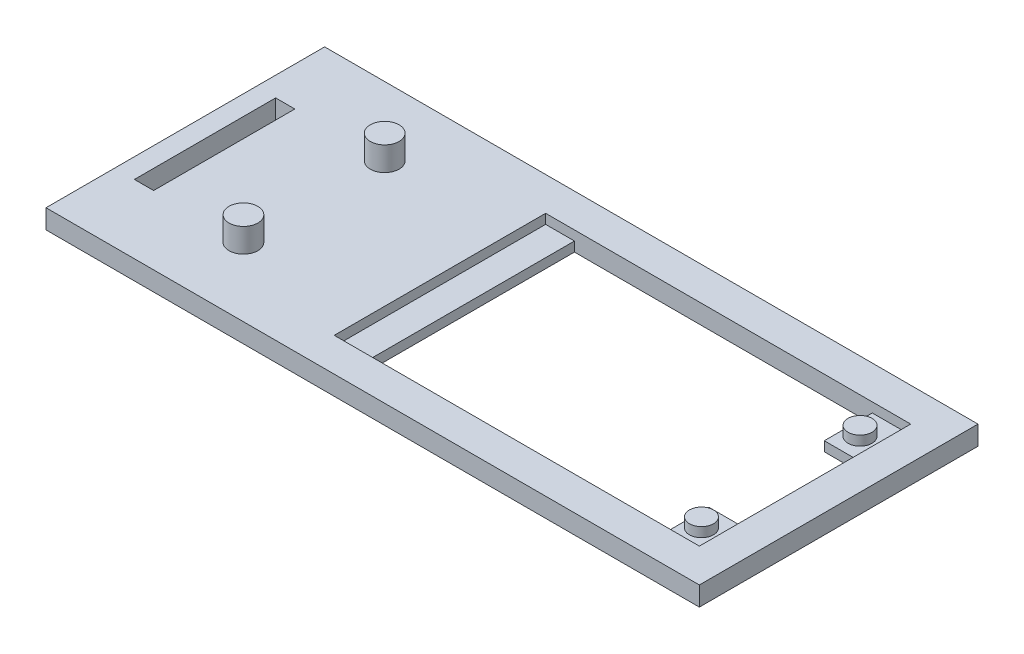
from build123d import *

# Parameters (mm, degrees)
SKETCH1_W             = 68
SKETCH1_H             = 29
BASE_DEPTH            = 2
SKETCH2_R             = 1.5
LEFT_PEG_DEPTH        = 2.5
SKETCH3_R             = 1.5
RIGHT_PEG_DEPTH       = 2.5
SKETCH4_W             = 2
SKETCH4_H             = 14.7
ACCEL_WIRE_HOLE_DEPTH = 2.5
SKETCH5_W             = 38
SKETCH5_H             = 22
OUTER_CUT_DEPTH       = 1
SKETCH6_W             = 31
SKETCH6_H             = 22
INNER_CUT_DEPTH       = 1
SKETCH7_W             = 4
SKETCH7_H             = 12
BETWEEN_PEG_CUT_DEPTH = 1
SKETCH8_R             = 1.25
PEGS_DEPTH            = 1


with BuildPart() as part:
    # Sketch1 → base (new body)
    with BuildSketch(Plane(origin=(0, 0, 0), x_dir=(1, 0, 0), z_dir=(0, 1, 0))):
        with Locations((6.444444444, 2.555555556)):
            Rectangle(SKETCH1_W, SKETCH1_H)
    extrude(amount=BASE_DEPTH)

    # Sketch2 → left peg (add)
    with BuildSketch(Plane(origin=(0, 2, 0), x_dir=(1, 0, 0), z_dir=(0, 1, 0))):
        with Locations(Location((-14.155555556, -4.794444444, 0), (0, 0, 270))):
            Circle(SKETCH2_R)
    extrude(amount=LEFT_PEG_DEPTH)

    # Sketch3 → right peg (add)
    with BuildSketch(Plane(origin=(0, 2, 0), x_dir=(1, 0, 0), z_dir=(0, 1, 0))):
        with Locations(Location((-14.155555556, 9.905555556, 0), (0, 0, 270))):
            Circle(SKETCH3_R)
    extrude(amount=RIGHT_PEG_DEPTH)

    # Sketch4 → accel wire hole (cut)
    with BuildSketch(Plane(origin=(0, 2, 0), x_dir=(1, 0, 0), z_dir=(0, 1, 0))):
        with Locations((-24.505555556, 2.555555556)):
            Rectangle(SKETCH4_W, SKETCH4_H)
    extrude(amount=-ACCEL_WIRE_HOLE_DEPTH, mode=Mode.SUBTRACT)

    # Sketch5 → outer cut (cut)
    with BuildSketch(Plane(origin=(0, 2, 0), x_dir=(1, 0, 0), z_dir=(0, 1, 0))):
        with Locations((17.944444444, 2.555555556)):
            Rectangle(SKETCH5_W, SKETCH5_H)
    extrude(amount=-OUTER_CUT_DEPTH, mode=Mode.SUBTRACT)

    # Sketch6 → inner cut (cut)
    with BuildSketch(Plane(origin=(0, 1, 0), x_dir=(1, 0, 0), z_dir=(0, 1, 0))):
        with Locations((17.444444444, 2.555555556)):
            Rectangle(SKETCH6_W, SKETCH6_H)
    extrude(amount=-INNER_CUT_DEPTH, mode=Mode.SUBTRACT)

    # Sketch7 → between peg cut (cut)
    with BuildSketch(Plane(origin=(0, 1, 0), x_dir=(1, 0, 0), z_dir=(0, 1, 0))):
        with Locations((34.944444444, 2.555555556)):
            Rectangle(SKETCH7_W, SKETCH7_H)
    extrude(amount=-BETWEEN_PEG_CUT_DEPTH, mode=Mode.SUBTRACT)

    # Sketch8 → pegs (add)
    with BuildSketch(Plane(origin=(0, 1, 0), x_dir=(1, 0, 0), z_dir=(0, 1, 0))):
        with Locations(Location((34.414871673, 10.805555556, 0), (0, 0, 270))):
            Circle(SKETCH8_R)
        with Locations(Location((34.414871673, -5.694444444, 0), (0, 0, 270))):
            Circle(SKETCH8_R)
    extrude(amount=PEGS_DEPTH)


solid = part.part
